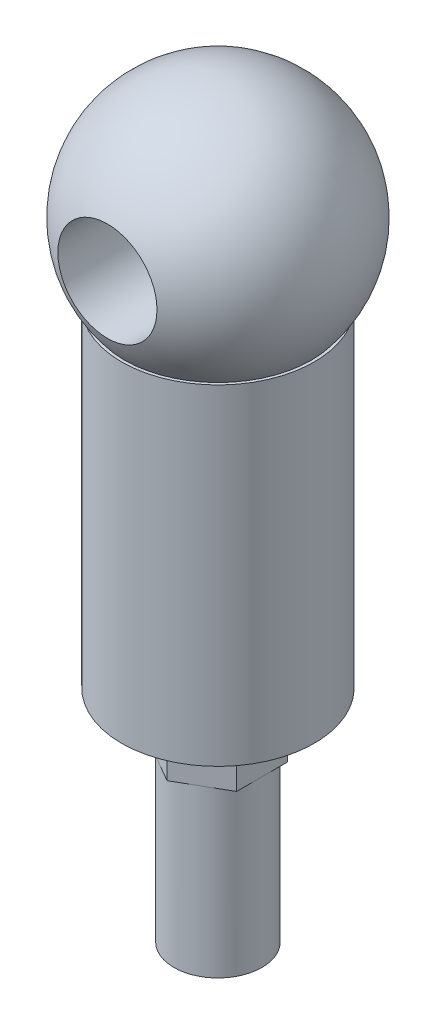
from build123d import *

# Parameters (mm, degrees)
EXTRUDE_1_DEPTH     = 5
SKETCH_2_R          = 8.75
EXTRUDE_2_DEPTH     = 30
SKETCH_4_R          = 4.5
CUT_EXTRUDE_1_DEPTH = 25
SKETCH_5_R          = 4
EXTRUDE_3_DEPTH     = 15


with BuildPart() as part:
    # 草图1 → 凸台-拉伸1 (new body)
    with BuildSketch(Plane(origin=(0, 0, 0), x_dir=(1, 0, 0), z_dir=(0, 1, 0))):
        Polygon((0, 4.618802154), (-4, 2.309401077), (-4, -2.309401077), (0, -4.618802154), (4, -2.309401077), (4, 2.309401077), align=None)
    extrude(amount=EXTRUDE_1_DEPTH)

    # 草图2 → 凸台-拉伸2 (add)
    with BuildSketch(Plane(origin=(0, 5, 0), x_dir=(1, 0, 0), z_dir=(0, 1, 0))):
        with Locations(Location((0, 0, 0), (0, 0, 270))):
            Circle(SKETCH_2_R)
    extrude(amount=EXTRUDE_2_DEPTH)

    # 草图3 → 旋转1 (revolve)
    with BuildSketch(Plane.XY):
        with BuildLine():
            ThreePointArc((0, 31), (11, 42), (0, 53))
            Line((0, 53), (0, 31))
        make_face()
    revolve(axis=Axis((0, 53, 0), (0, -1, 0)))

    # 草图4 → 切除-拉伸1 (cut, symmetric)
    with BuildSketch(Plane.XY):
        with Locations((0, 42)):
            Circle(SKETCH_4_R)
    extrude(amount=CUT_EXTRUDE_1_DEPTH, both=True, mode=Mode.SUBTRACT)

    # 草图5 → 凸台-拉伸3 (add)
    with BuildSketch(Plane.XZ):
        with Locations(Location((0, 0, 0), (0, 0, 120))):
            Circle(SKETCH_5_R)
    extrude(amount=EXTRUDE_3_DEPTH)


solid = part.part
